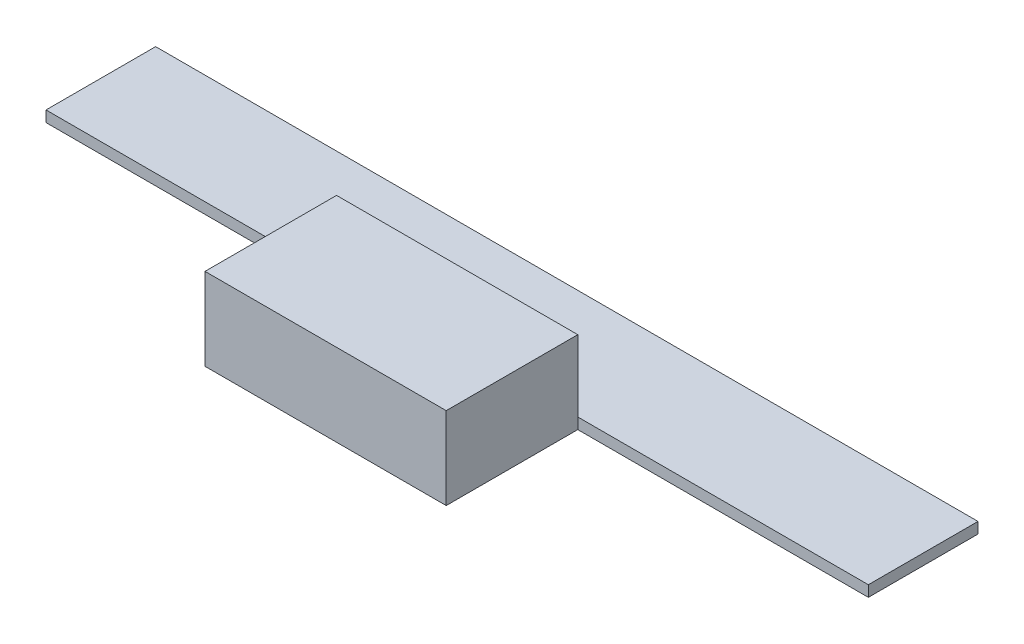
from build123d import *

# Parameters (mm, degrees)
SKETCH5_W           = 44
SKETCH5_H           = 24
BOSS_EXTRUDE3_DEPTH = 15
SHELL1_T            = -2
SKETCH7_W           = 2
SKETCH7_H           = 11.017608059
BOSS_EXTRUDE4_DEPTH = 10
SKETCH9_W           = 150
SKETCH9_H           = 2
BOSS_EXTRUDE5_DEPTH = 20


with BuildPart() as part:
    # Sketch5 → Boss-Extrude3 (new body)
    with BuildSketch(Plane(origin=(0, 0, 0), x_dir=(1, 0, 0), z_dir=(0, 1, 0))):
        Rectangle(SKETCH5_W, SKETCH5_H)
    extrude(amount=BOSS_EXTRUDE3_DEPTH)

    # Shell1
    shell1_openings = [part.faces().sort_by_distance(p)[0] for p in [
        (0, 7.5, -12),
    ]]
    offset(amount=SHELL1_T, openings=shell1_openings, kind=Kind.INTERSECTION)

    # Sketch7 → Boss-Extrude4 (add)
    with BuildSketch(Plane(origin=(-20, 0, 0), x_dir=(0, 0, -1), z_dir=(1, 0, 0))):
        with Locations((11, 7.49119597)):
            Rectangle(SKETCH7_W, SKETCH7_H)
    boss_extrude4 = extrude(amount=BOSS_EXTRUDE4_DEPTH)

    # Mirror1: Boss-Extrude4 across plane
    add(boss_extrude4.mirror(Plane(origin=(0, 0, 0), x_dir=(0, 0, 1), z_dir=(1, 0, 0))))

    # Sketch9 → Boss-Extrude5 (add)
    with BuildSketch(Plane(origin=(0, 0, -12), x_dir=(-1, 0, 0), z_dir=(0, 0, -1))):
        with Locations((0, 1)):
            Rectangle(SKETCH9_W, SKETCH9_H)
    extrude(amount=BOSS_EXTRUDE5_DEPTH)


solid = part.part
